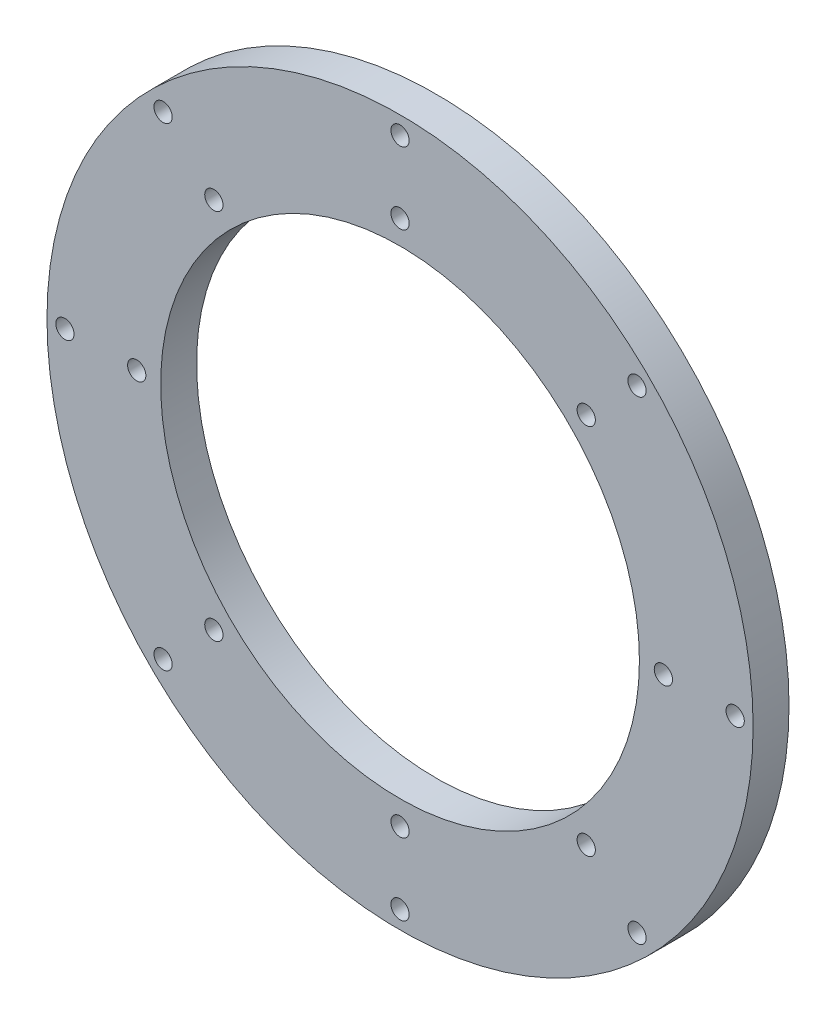
from build123d import *

# Parameters (mm, degrees)
SKETCH_1_R                   = 59
SKETCH_1_R_2                 = 50.5
EXTRUDE_1_DEPTH              = 6
SKETCH_2_R                   = 1.525
CUT_EXTRUDE_1_DEPTH          = 6
EXTRUDE_START                = -6
SKETCH_6_R                   = 50.5
SKETCH_6_R_2                 = 40
EXTRUDE_2_DEPTH              = 6
SKETCH_7_R                   = 1.525
CUT_EXTRUDE_3_DEPTH          = 6
HOLE_WIZARD_M3_2_D           = 3.05
HOLE_WIZARD_M3_2_CSINK_D     = 6.6
HOLE_WIZARD_M3_2_CSINK_ANGLE = 90
PATTERN_CIRCULAR_2_COUNT     = 8


with BuildPart() as part:
    # 草图1 → 凸台-拉伸1 (new body)
    with BuildSketch(Plane.XY):
        Circle(SKETCH_1_R)
        Circle(SKETCH_1_R_2, mode=Mode.SUBTRACT)
    extrude(amount=EXTRUDE_1_DEPTH)

    # 草图2 → 切除-拉伸1 (cut)
    with BuildSketch(Plane.XY.offset(6)):
        with Locations((0, 56)):
            Circle(SKETCH_2_R)
        with Locations((39.597979746, 39.597979746)):
            Circle(SKETCH_2_R)
        with Locations((56, 0)):
            Circle(SKETCH_2_R)
        with Locations((39.597979746, -39.597979746)):
            Circle(SKETCH_2_R)
        with Locations((0, -56)):
            Circle(SKETCH_2_R)
        with Locations((-39.597979746, -39.597979746)):
            Circle(SKETCH_2_R)
        with Locations((-56, 0)):
            Circle(SKETCH_2_R)
        with Locations((-39.597979746, 39.597979746)):
            Circle(SKETCH_2_R)
    extrude(amount=-CUT_EXTRUDE_1_DEPTH, mode=Mode.SUBTRACT)

    # 草图6 → 凸台-拉伸2 (add)
    with BuildSketch(Plane.XY.offset(6).offset(EXTRUDE_START)):
        Circle(SKETCH_6_R)
        Circle(SKETCH_6_R_2, mode=Mode.SUBTRACT)
    extrude(amount=EXTRUDE_2_DEPTH)

    # 草图7 → 切除-拉伸3 (cut)
    with BuildSketch(Plane(origin=(0, 0, 0), x_dir=(-1, 0, 0), z_dir=(0, 0, -1))):
        with Locations((0, 44)):
            Circle(SKETCH_7_R)
        with Locations((31.112698372, 31.112698372)):
            Circle(SKETCH_7_R)
        with Locations((44, 0)):
            Circle(SKETCH_7_R)
        with Locations((31.112698372, -31.112698372)):
            Circle(SKETCH_7_R)
        with Locations((0, -44)):
            Circle(SKETCH_7_R)
        with Locations((-31.112698372, -31.112698372)):
            Circle(SKETCH_7_R)
        with Locations((-44, 0)):
            Circle(SKETCH_7_R)
        with Locations((-31.112698372, 31.112698372)):
            Circle(SKETCH_7_R)
    extrude(amount=-CUT_EXTRUDE_3_DEPTH, mode=Mode.SUBTRACT)

    # M3 十字槽沉头木螺钉的锥形沉头孔2 (through all)
    with Locations(Plane(origin=(0, 0, 0), x_dir=(-1, 0, 0), z_dir=(0, 0, -1))):
        with Locations((0, 44)):
            hole_wizard_m3_2 = CounterSinkHole(HOLE_WIZARD_M3_2_D / 2, HOLE_WIZARD_M3_2_CSINK_D / 2, counter_sink_angle=HOLE_WIZARD_M3_2_CSINK_ANGLE)

    # 阵列(圆周)2: M3 十字槽沉头木螺钉的锥形沉头孔2 ×8 about axis
    pattern_circular_2_axis = Axis((0, 0, 0), (0, 0, 1))
    for i in range(1, PATTERN_CIRCULAR_2_COUNT):
        add(hole_wizard_m3_2.rotate(pattern_circular_2_axis, i * 360 / PATTERN_CIRCULAR_2_COUNT), mode=Mode.SUBTRACT)


solid = part.part
